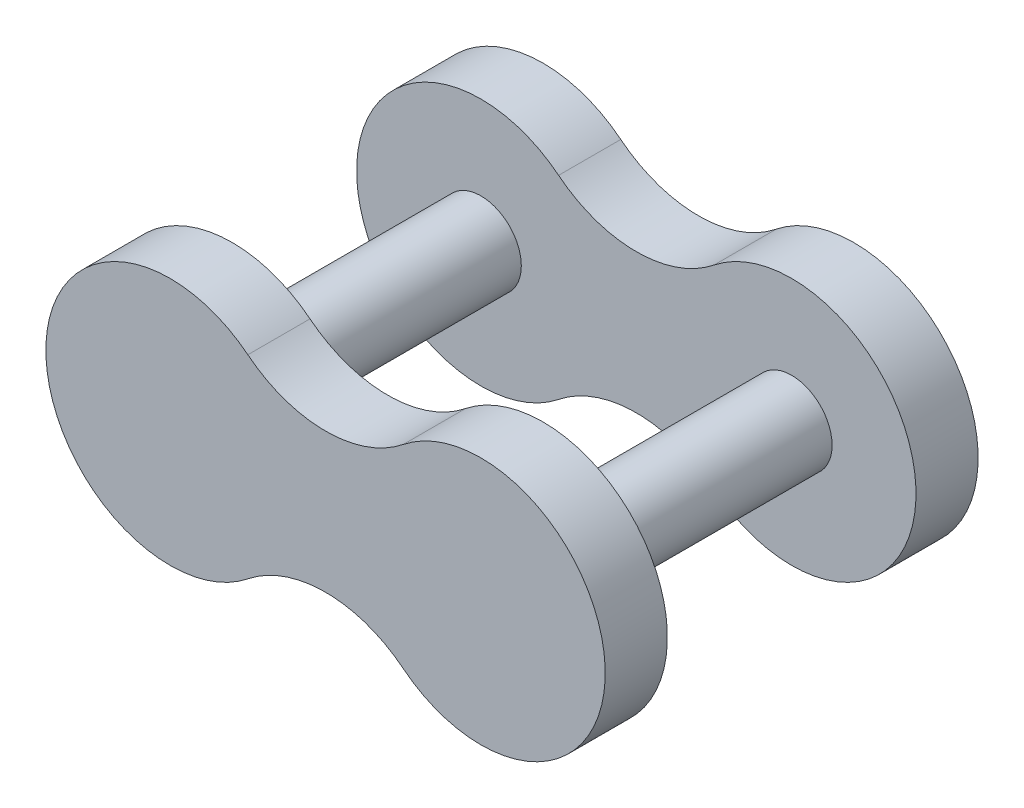
from build123d import *

# Parameters (mm, degrees)
SKETCH1_R             = 0.8255
BOSS_EXTRUDE1_DEPTH   = 2.54
BOSS_EXTRUDE1_2_DEPTH = 2.54
BOSS_EXTRUDE2_DEPTH   = 1.27


with BuildPart() as part:
    # Sketch1 → Boss-Extrude1 (new, symmetric)
    with BuildSketch(Plane.XY):
        with Locations((3.175, 0)):
            Circle(SKETCH1_R)
    extrude(amount=BOSS_EXTRUDE1_DEPTH, both=True)



with BuildPart() as body_2:
    # Sketch1 → Boss-Extrude1 2 (new, symmetric)
    with BuildSketch(Plane.XY):
        with Locations((-3.175, 0)):
            Circle(SKETCH1_R)
    extrude(amount=BOSS_EXTRUDE1_2_DEPTH, both=True)


with BuildPart() as part_1:
    add(part.part)

    add(body_2.part)  # Boss-Extrude2 merges body 2
    # Sketch2 → Boss-Extrude2 (add)
    with BuildSketch(Plane.XY.offset(2.54)):
        with BuildLine():
            ThreePointArc((1.5875, -1.982786864), (5.715, 0), (1.5875, 1.982786864))
            ThreePointArc((1.5875, 1.982786864), (0, 1.425573729), (-1.5875, 1.982786864))
            ThreePointArc((-1.5875, 1.982786864), (-5.715, 0), (-1.5875, -1.982786864))
            ThreePointArc((-1.5875, -1.982786864), (0, -1.425573729), (1.5875, -1.982786864))
        make_face()
    boss_extrude2 = extrude(amount=BOSS_EXTRUDE2_DEPTH)

    # Mirror1: Boss-Extrude2 across plane
    add(boss_extrude2.mirror(Plane.XY))


solid = part_1.part
